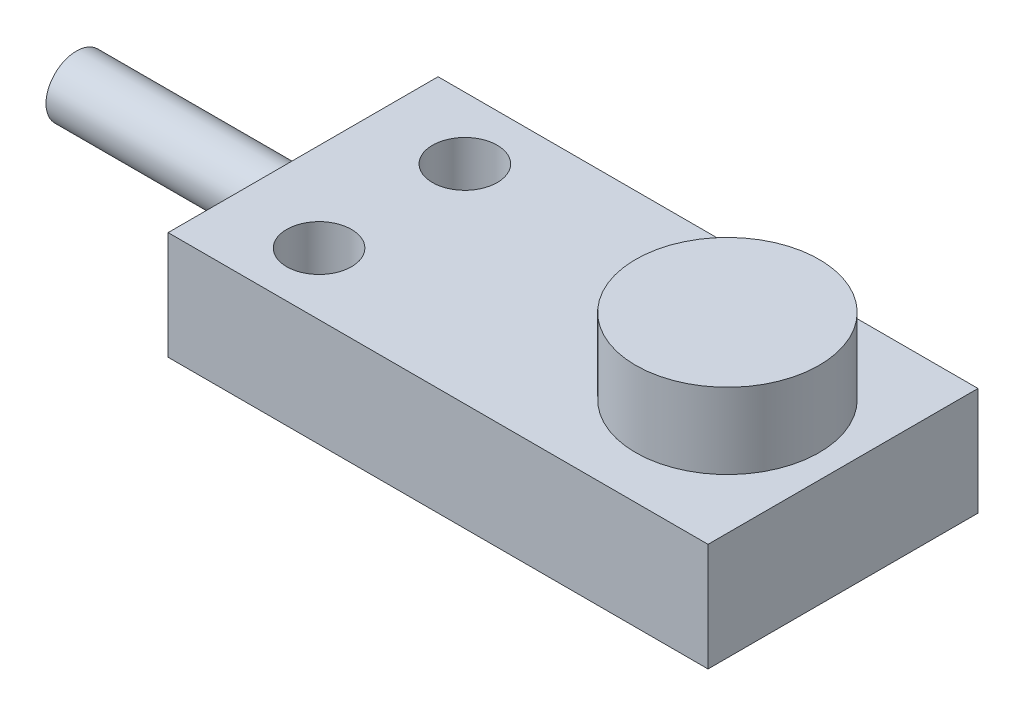
from build123d import *

# Parameters (mm, degrees)
SKETCH_1_W      = 50
SKETCH_1_H      = 25
SKETCH_1_R      = 3
EXTRUDE_1_DEPTH = 10
SKETCH_2_R      = 2.808756841
EXTRUDE_2_DEPTH = 21
SKETCH_1_3_R    = 8.5
EXTRUDE_3_DEPTH = 17


with BuildPart() as part:
    # 草图1 → 凸台-拉伸1 (new body)
    with BuildSketch(Plane(origin=(0, 0, 0), x_dir=(1, 0, 0), z_dir=(0, 1, 0))):
        Rectangle(SKETCH_1_W, SKETCH_1_H)
        with Locations((-16.76980198, -6.75)):
            Circle(SKETCH_1_R, mode=Mode.SUBTRACT)
        with Locations((-16.76980198, 6.75)):
            Circle(SKETCH_1_R, mode=Mode.SUBTRACT)
    extrude(amount=EXTRUDE_1_DEPTH)

    # 草图2 → 凸台-拉伸2 (add)
    with BuildSketch(Plane.ZY.offset(25)):
        with Locations((0, 5)):
            Circle(SKETCH_2_R)
    extrude(amount=EXTRUDE_2_DEPTH)

    # 草图1<3> → 凸台-拉伸3 (add)
    with BuildSketch(Plane(origin=(0, 0, 0), x_dir=(1, 0, 0), z_dir=(0, 1, 0))):
        with Locations((14.294554455, 0)):
            Circle(SKETCH_1_3_R)
    extrude(amount=EXTRUDE_3_DEPTH)


solid = part.part
